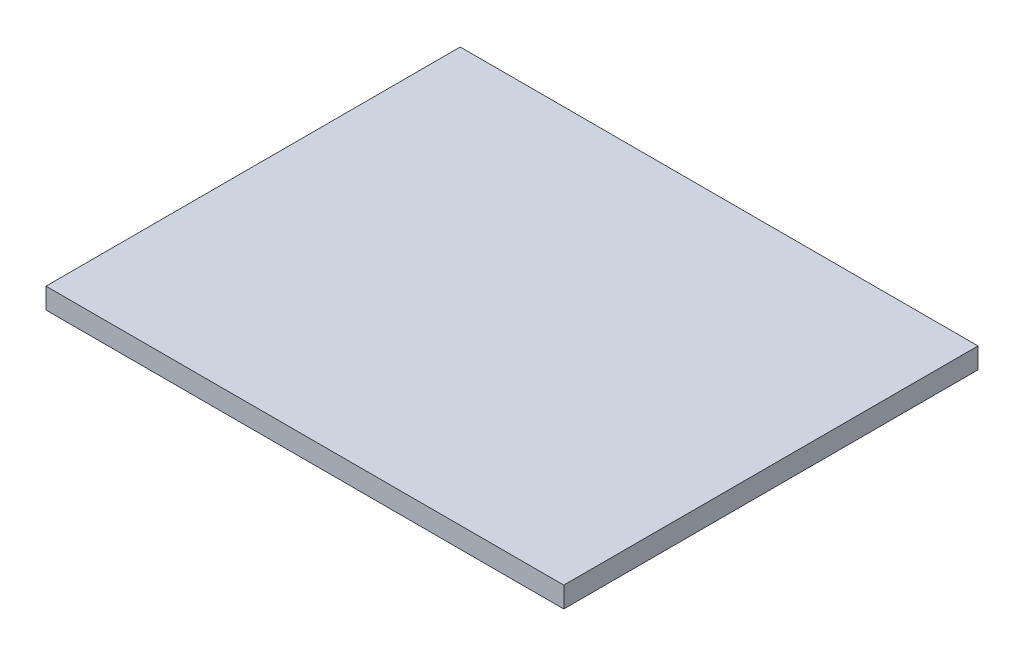
from build123d import *

# Parameters (mm, degrees)
SKETCH_1_W      = 5000
SKETCH_1_H      = 4000
EXTRUDE_1_DEPTH = 200


with BuildPart() as part:
    # Эскиз1 → Бобышка-Вытянуть1 (new body)
    with BuildSketch(Plane(origin=(0, 0, 0), x_dir=(1, 0, 0), z_dir=(0, 1, 0))):
        Rectangle(SKETCH_1_W, SKETCH_1_H)
    extrude(amount=EXTRUDE_1_DEPTH)


solid = part.part
